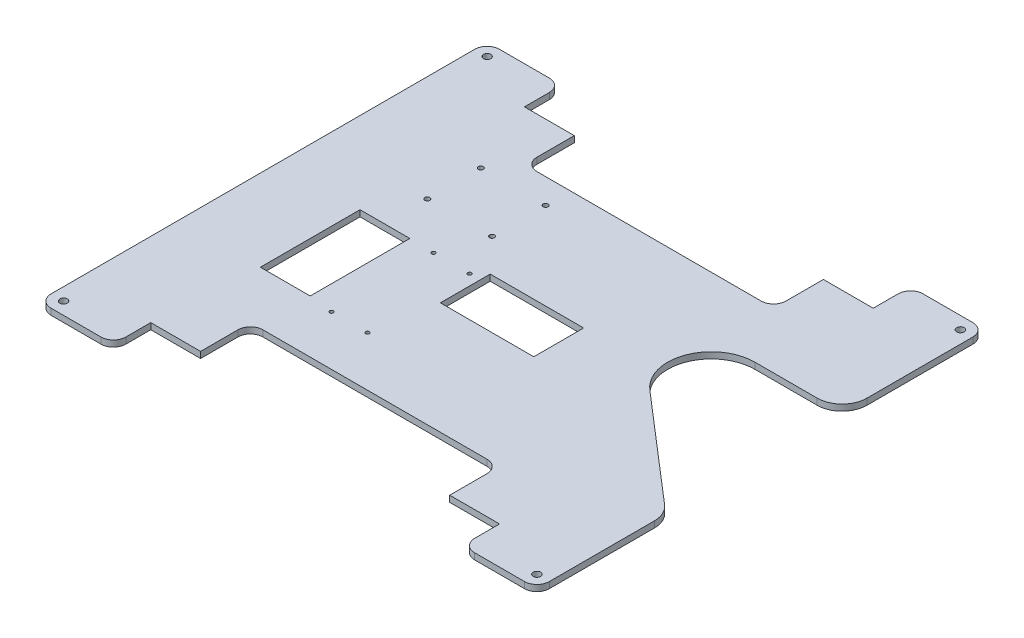
from build123d import *

# Parameters (mm, degrees)
SKETCH_4_R                = 15
EXTRUDE_1_DEPTH           = 5
SKETCH_6_R                = 1.5
SKETCH_6_R_2              = 2
SKETCH_6_R_3              = 1.6
SKETCH_6_R_4              = 1.75
CUT_EXTRUDE_2_DEPTH       = 5
SKETCH_8_R                = 3
CUT_EXTRUDE_4_DEPTH       = 10
FILLET_1_R                = 10
CUT_EXTRUDE_24_DEPTH      = 270.118932816
CUT_EXTRUDE_24_DEPTH_BACK = 270.118932816
SKETCH_23_W               = 75
SKETCH_23_H               = 40
SKETCH_23_W_2             = 40
SKETCH_23_H_2             = 80
CUT_EXTRUDE_26_DEPTH      = 270.118932816
FILLET_2_R                = 20


with BuildPart() as part:
    # 草圖4 → 伸長1 (new body)
    with BuildSketch(Plane(origin=(0, 0, 0), x_dir=(1, 0, 0), z_dir=(0, 1, 0))):
        Polygon((-200, 180), (-140, 180), (-140, 150), (-100, 150), (-100, 110), (100, 110), (100, 150), (140, 150), (140, 180), (200, 180), (200, -180), (140, -180), (140, -150), (100, -150), (100, -110), (-100, -110), (-100, -150), (-140, -150), (-140, -180), (-200, -180), align=None)
        with Locations(Location((0, 0, 0), (0, 0, 270))):
            Circle(SKETCH_4_R, mode=Mode.SUBTRACT)
    extrude(amount=EXTRUDE_1_DEPTH)

    # 草圖6 → 伸長2 (cut)
    with BuildSketch(Plane(origin=(0, 5, 0), x_dir=(-1, 0, 0), z_dir=(0, 1, 0))):
        with Locations(Location((75, -12, 0), (0, 0, 90))):
            Circle(SKETCH_6_R)
        with Locations(Location((46, -12, 0), (0, 0, 90))):
            Circle(SKETCH_6_R)
        with Locations(Location((46, 70, 0), (0, 0, 90))):
            Circle(SKETCH_6_R)
        with Locations(Location((75, 70, 0), (0, 0, 90))):
            Circle(SKETCH_6_R)
        with Locations(Location((63, -90, 0), (0, 0, 90))):
            Circle(SKETCH_6_R_2)
        with Locations(Location((115, -90, 0), (0, 0, 90))):
            Circle(SKETCH_6_R_2)
        with Locations(Location((115, -47, 0), (0, 0, 90))):
            Circle(SKETCH_6_R_2)
        with Locations(Location((63, -47, 0), (0, 0, 90))):
            Circle(SKETCH_6_R_2)
        with Locations(Location((130, -10, 0), (0, 0, 90))):
            Circle(SKETCH_6_R_3)
        with Locations(Location((130, 65, 0), (0, 0, 90))):
            Circle(SKETCH_6_R_3)
        with Locations(Location((99, 65, 0), (0, 0, 90))):
            Circle(SKETCH_6_R_3)
        with Locations(Location((99, -10, 0), (0, 0, 90))):
            Circle(SKETCH_6_R_3)
        with Locations(Location((33, 16.5, 0), (0, 0, 90))):
            Circle(SKETCH_6_R_4)
        with Locations(Location((33, -16.5, 0), (0, 0, 90))):
            Circle(SKETCH_6_R_4)
        with Locations(Location((-33, -16.5, 0), (0, 0, 90))):
            Circle(SKETCH_6_R_4)
        with Locations(Location((-33, 16.5, 0), (0, 0, 90))):
            Circle(SKETCH_6_R_4)
    extrude(amount=-CUT_EXTRUDE_2_DEPTH, mode=Mode.SUBTRACT)

    # 草圖8 → 伸長4 (cut)
    with BuildSketch(Plane(origin=(0, 5, 0), x_dir=(1, 0, 0), z_dir=(0, 1, 0))):
        with Locations(Location((190, 170, 0), (0, 0, 270))):
            Circle(SKETCH_8_R)
        with Locations(Location((-190, 170, 0), (0, 0, 270))):
            Circle(SKETCH_8_R)
        with Locations(Location((-190, -170, 0), (0, 0, 270))):
            Circle(SKETCH_8_R)
        with Locations(Location((190, -170, 0), (0, 0, 270))):
            Circle(SKETCH_8_R)
    extrude(amount=-CUT_EXTRUDE_4_DEPTH, mode=Mode.SUBTRACT)

    # 圓角1
    fillet_1_edges = [part.edges().sort_by_distance(p)[0] for p in [
        (-200, 2.5, -180),
        (-140, 2.5, -180),
        (-100, 2.5, -110),
        (100, 2.5, -110),
        (140, 2.5, -180),
        (200, 2.5, -180),
        (200, 2.5, 180),
        (140, 2.5, 180),
        (100, 2.5, 110),
        (-100, 2.5, 110),
        (-140, 2.5, 180),
        (-200, 2.5, 180),
    ]]
    fillet(fillet_1_edges, radius=FILLET_1_R)

    # 草圖21 → 伸長24 (cut, two sides: drawn at the far end of the back side and taken through both)
    with BuildSketch(Plane(origin=(0, 5, 0), x_dir=(1, 0, 0), z_dir=(0, 1, 0)).offset(-CUT_EXTRUDE_24_DEPTH_BACK)):
        with BuildLine():
            Line((1160.368223513, 65), (200, 65))
            Line((200, 65), (130, 65))
            ThreePointArc((130, 65), (97.189752759, 42.185551936), (107.153658755, 3.485010057))
            Line((107.153658755, 3.485010057), (200, -76.514989943))
            Line((200, -76.514989943), (927.547251098, -703.397851531))
            Line((927.547251098, -703.397851531), (2765.756739288, -1260.366770288))
            Line((2765.756739288, -1260.366770288), (2998.577711703, -491.968918756))
            Line((2998.577711703, -491.968918756), (1160.368223513, 65))
        make_face()
    extrude(amount=CUT_EXTRUDE_24_DEPTH + CUT_EXTRUDE_24_DEPTH_BACK, mode=Mode.SUBTRACT)

    # 草圖23 → 伸長26 (cut, through all)
    with BuildSketch(Plane(origin=(0, 5, 0), x_dir=(1, 0, 0), z_dir=(0, 1, 0))):
        Rectangle(SKETCH_23_W, SKETCH_23_H)
        with Locations((-114.5, -27.5)):
            Rectangle(SKETCH_23_W_2, SKETCH_23_H_2)
    extrude(amount=-CUT_EXTRUDE_26_DEPTH, mode=Mode.SUBTRACT)

    # 圓角2
    fillet_2_edges = [part.edges().sort_by_distance(p)[0] for p in [
        (200, 2.5, 76.514989943),
        (200, 2.5, -65),
    ]]
    fillet(fillet_2_edges, radius=FILLET_2_R)


solid = part.part
